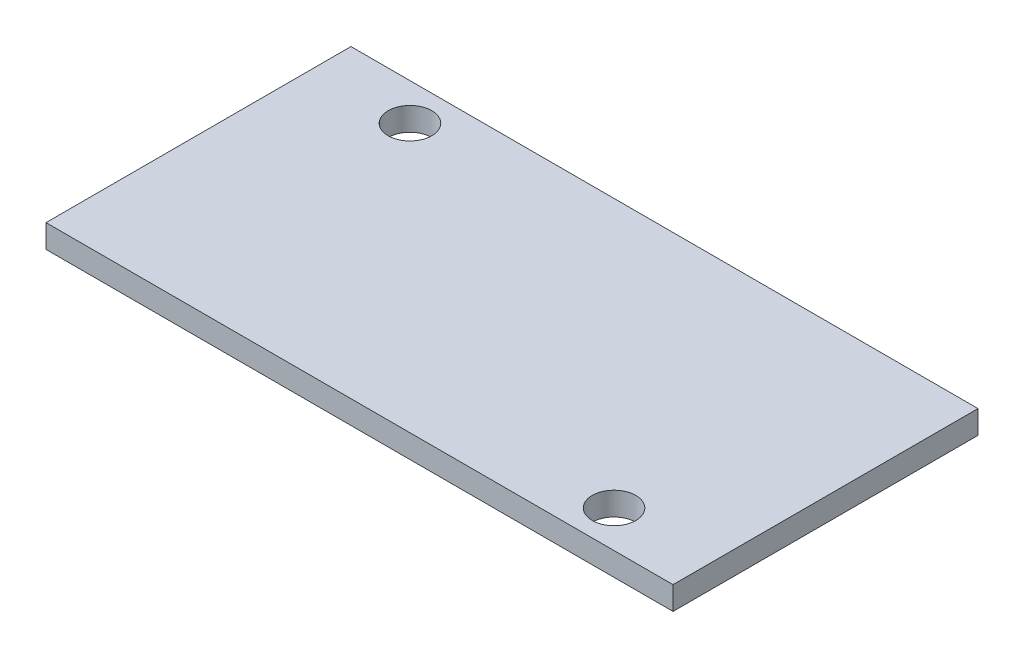
from build123d import *

# Parameters (mm, degrees)
SKETCH_1_W          = 43.18
SKETCH_1_H          = 21
EXTRUDE_1_DEPTH     = 1.6
SKETCH_2_R          = 1.5
CUT_EXTRUDE_1_DEPTH = 10


with BuildPart() as part:
    # 草图1 → 凸台-拉伸1 (new body)
    with BuildSketch(Plane(origin=(0, 0, 0), x_dir=(1, 0, 0), z_dir=(0, 1, 0))):
        Rectangle(SKETCH_1_W, SKETCH_1_H)
    extrude(amount=EXTRUDE_1_DEPTH)

    # 草图2 → 切除-拉伸1 (cut)
    with BuildSketch(Plane(origin=(0, 1.6, 0), x_dir=(1, 0, 0), z_dir=(0, 1, 0))):
        with Locations(Location((-14.986, 7.96, 0), (0, 0, 270))):
            Circle(SKETCH_2_R)
        with Locations(Location((14.986, -7.96, 0), (0, 0, 270))):
            Circle(SKETCH_2_R)
    extrude(amount=-CUT_EXTRUDE_1_DEPTH, mode=Mode.SUBTRACT)


solid = part.part
